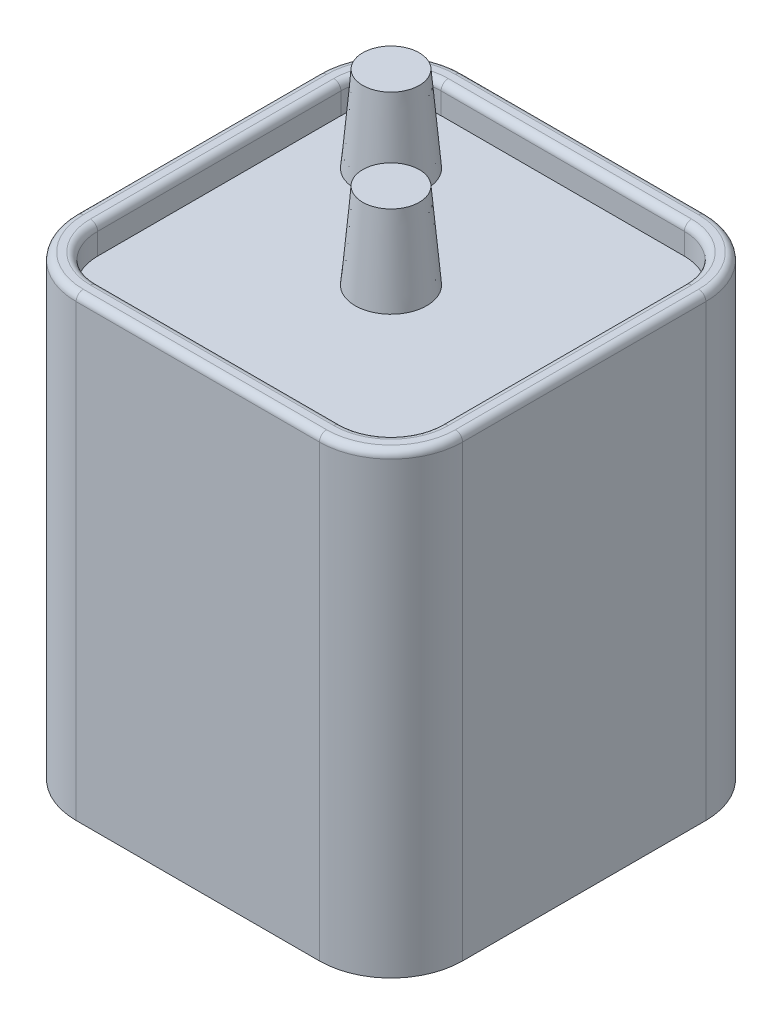
from build123d import *

# Parameters (mm, degrees)
SKETCH1_W                 = 68.58
SKETCH1_H                 = 68.58
BASE_EXTRUDE_DEPTH        = 81.026
SIDE_FILLETS_R            = 12.7
TOP_CUT_DEPTH             = 5.08
TOP_FACE_FILLET_R         = 1.27
SKETCH4_R                 = 6.35
TERMINALS_DEPTH           = 15.24
TERMINALS_DRAFT           = 5
TERMINALS_PROFILE_2_DEPTH = 15.24
TERMINALS_PROFILE_2_DRAFT = 5


with BuildPart() as part:
    # Sketch1 → Base Extrude (new body)
    with BuildSketch(Plane(origin=(0, 0, 0), x_dir=(1, 0, 0), z_dir=(0, 1, 0))):
        Rectangle(SKETCH1_W, SKETCH1_H)
    extrude(amount=BASE_EXTRUDE_DEPTH)

    # Side Fillets
    side_fillets_edges = [part.edges().sort_by_distance(p)[0] for p in [
        (34.29, 40.513, 34.29),
        (-34.29, 40.513, 34.29),
        (-34.29, 40.513, -34.29),
        (34.29, 40.513, -34.29),
    ]]
    fillet(side_fillets_edges, radius=SIDE_FILLETS_R)

    # Sketch3 → Top Cut (cut)
    with BuildSketch(Plane(origin=(0, 81.026, 0), x_dir=(1, 0, 0), z_dir=(0, 1, 0))):
        with BuildLine():
            Line((21.59, 30.48), (-21.59, 30.48))
            ThreePointArc((-21.59, 30.48), (-27.876179285, 27.876179285), (-30.48, 21.59))
            Line((-30.48, 21.59), (-30.48, -21.59))
            ThreePointArc((-30.48, -21.59), (-27.876179285, -27.876179285), (-21.59, -30.48))
            Line((-21.59, -30.48), (21.59, -30.48))
            ThreePointArc((21.59, -30.48), (27.876179285, -27.876179285), (30.48, -21.59))
            Line((30.48, -21.59), (30.48, 21.59))
            ThreePointArc((30.48, 21.59), (27.876179285, 27.876179285), (21.59, 30.48))
        make_face()
    extrude(amount=-TOP_CUT_DEPTH, mode=Mode.SUBTRACT)

    # Top Face Fillet
    top_face_fillet_edges = [part.edges().sort_by_distance(p)[0] for p in [
        (-34.29, 81.026, 0),
        (0, 81.026, -34.29),
        (34.29, 81.026, 0),
        (0, 81.026, 34.29),
        (-30.570256121, 81.026, 30.570256121),
        (30.570256121, 81.026, 30.570256121),
        (30.570256121, 81.026, -30.570256121),
        (-30.570256121, 81.026, -30.570256121),
        (27.876179285, 81.026, -27.876179285),
        (0, 81.026, -30.48),
        (-27.876179285, 81.026, -27.876179285),
        (-30.48, 81.026, 0),
        (-27.876179285, 81.026, 27.876179285),
        (0, 81.026, 30.48),
        (27.876179285, 81.026, 27.876179285),
        (30.48, 81.026, 0),
    ]]
    fillet(top_face_fillet_edges, radius=TOP_FACE_FILLET_R)


with BuildPart() as terminals_tool:
    # Sketch4 → Terminals (with draft: the straight prism first)
    with BuildSketch(Plane(origin=(0, 75.946, 0), x_dir=(1, 0, 0), z_dir=(0, 1, 0))):
        Circle(SKETCH4_R)
    extrude(amount=TERMINALS_DEPTH)
    # Terminals: the draft: its side faces are tilted about the plane it starts from
    terminals_sides = [terminals_tool.faces().sort_by_distance(p)[0] for p in [
        (-6.35, 83.566, 0),
    ]]
    draft(terminals_sides, Plane(origin=(0, 75.946, 0), x_dir=(1, 0, 0), z_dir=(0, 1, 0)), TERMINALS_DRAFT)


with BuildPart() as part_1:
    add(part.part)

    # Terminals: add terminals_tool
    add(terminals_tool.part)


with BuildPart() as terminals_profile_2_tool:
    # Sketch4 → Terminals profile 2 (with draft: the straight prism first)
    with BuildSketch(Plane(origin=(0, 75.946, 0), x_dir=(1, 0, 0), z_dir=(0, 1, 0))):
        with Locations((-17.960512242, 17.960512242)):
            Circle(SKETCH4_R)
    extrude(amount=TERMINALS_PROFILE_2_DEPTH)
    # Terminals profile 2: the draft: its side faces are tilted about the plane it starts from
    terminals_profile_2_sides = [terminals_profile_2_tool.faces().sort_by_distance(p)[0] for p in [
        (-24.310512242, 83.566, -17.960512242),
    ]]
    draft(terminals_profile_2_sides, Plane(origin=(0, 75.946, 0), x_dir=(1, 0, 0), z_dir=(0, 1, 0)), TERMINALS_PROFILE_2_DRAFT)


with BuildPart() as part_2:
    add(part_1.part)

    # Terminals profile 2: add terminals_profile_2_tool
    add(terminals_profile_2_tool.part)


solid = part_2.part
